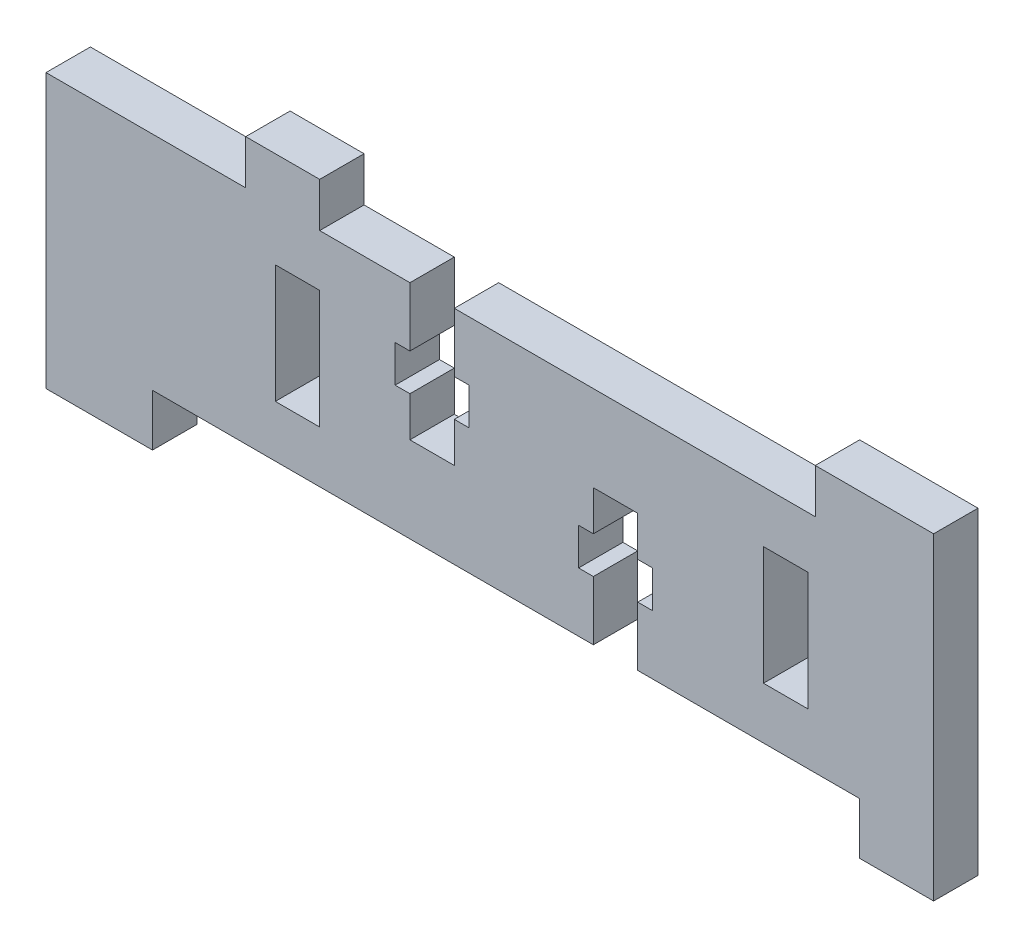
from build123d import *

# Parameters (mm, degrees)
SKETCH1_W           = 3
SKETCH1_H           = 8
BOSS_EXTRUDE1_DEPTH = 1.5


with BuildPart() as part:
    # Sketch1 → Boss-Extrude1 (new, symmetric)
    with BuildSketch(Plane.XY):
        Polygon((30.4, -9), (30.4, -5.5), (15.4, -5.5), (15.4, -1.5), (16.4, -1.5), (16.4, 1), (15.4, 1), (15.4, 3.7), (12.4, 3.7), (12.4, 1), (11.4, 1), (11.4, -1.5), (12.4, -1.5), (12.4, -5.5), (-17.4, -5.5), (-17.4, -9), (-24.6, -9), (-24.6, 9.5), (-11.1, 9.5), (-11.1, 12.5), (-6.1, 12.5), (-6.1, 9.5), (0, 9.5), (0, 5.5), (-1, 5.5), (-1, 3), (0, 3), (0, 0.3), (3, 0.3), (3, 3), (4, 3), (4, 5.5), (3, 5.5), (3, 9.5), (27.4, 9.5), (27.4, 12.5), (35.4, 12.5), (35.4, -9), align=None)
        with Locations((25.4, 2)):
            Rectangle(SKETCH1_W, SKETCH1_H, mode=Mode.SUBTRACT)
        with Locations((-7.6, 2)):
            Rectangle(SKETCH1_W, SKETCH1_H, mode=Mode.SUBTRACT)
    extrude(amount=BOSS_EXTRUDE1_DEPTH, both=True)


solid = part.part
